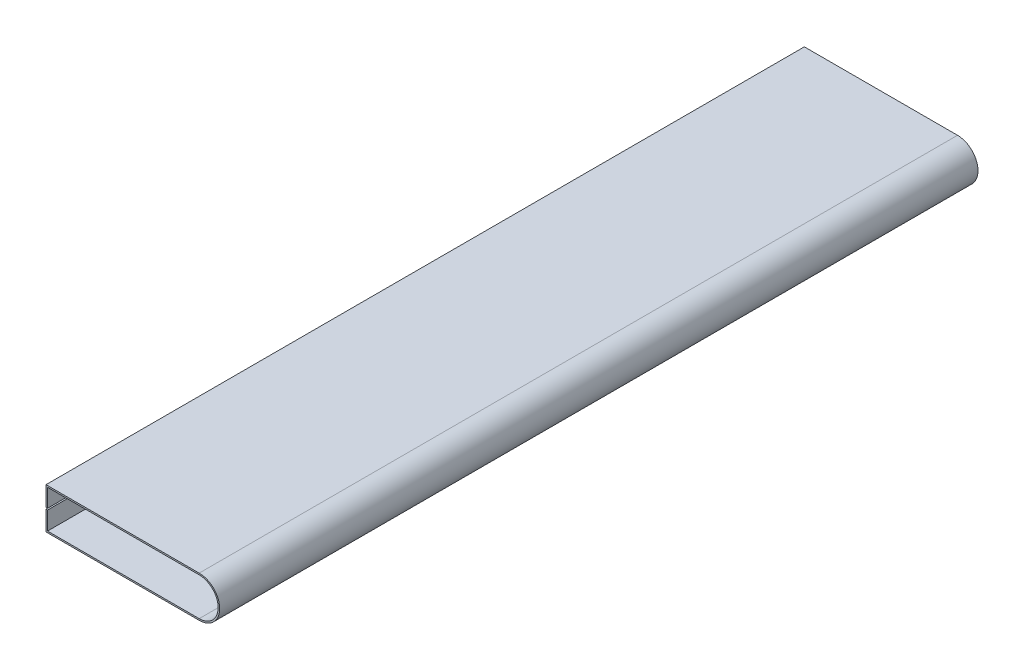
from build123d import *

# Parameters (mm, degrees)
BOSS_EXTRUDE1_DEPTH = 1000


with BuildPart() as part:
    # Sketch1 → Boss-Extrude1 (new body)
    with BuildSketch(Plane.XY):
        with BuildLine():
            Line((-119.957004607, 72.181122853), (82.042995393, 72.181122853))
            ThreePointArc((82.042995393, 72.181122853), (109.042995393, 45.181122853), (82.042995393, 18.181122853))
            Line((82.042995393, 18.181122853), (-119.957004607, 18.181122853))
            Line((-119.957004607, 18.181122853), (-119.957004607, 44.181122853))
            Line((-119.957004607, 44.181122853), (-117.957004607, 44.181122853))
            Line((-117.957004607, 44.181122853), (-117.957004607, 20.181122853))
            Line((-117.957004607, 20.181122853), (82.042995393, 20.181122853))
            ThreePointArc((82.042995393, 20.181122853), (107.042995393, 45.181122853), (82.042995393, 70.181122853))
            Line((82.042995393, 70.181122853), (-117.957004607, 70.181122853))
            Line((-117.957004607, 70.181122853), (-117.957004607, 46.181122853))
            Line((-117.957004607, 46.181122853), (-119.957004607, 46.181122853))
            Line((-119.957004607, 46.181122853), (-119.957004607, 72.181122853))
        make_face()
    extrude(amount=-BOSS_EXTRUDE1_DEPTH)


solid = part.part
